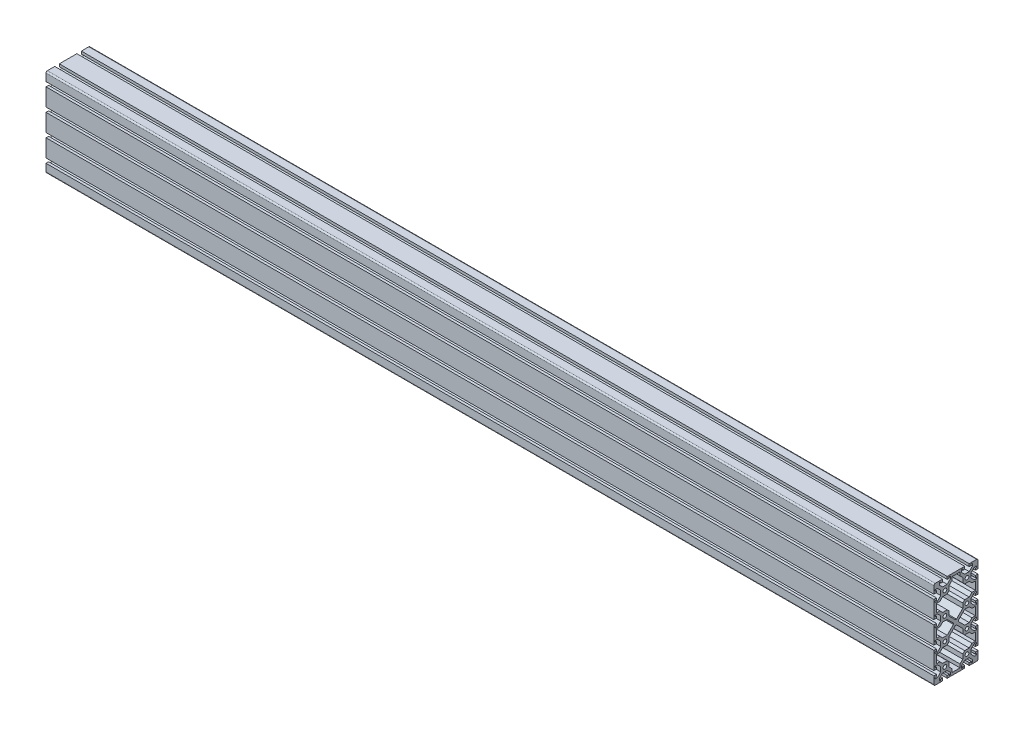
from build123d import *

# Parameters (mm, degrees)
SKETCH22_R                    = 3.35
F_80_SERIES_TS80_160M_1_DEPTH = 1610
M8X1_25_TAPPED_HOLE1_D        = 6.8
M8X1_25_TAPPED_HOLE1_DEPTH    = 30
M8X1_25_TAPPED_HOLE1_TIP      = 2.042926105
M8X1_25_TAPPED_HOLE2_D        = 6.8
M8X1_25_TAPPED_HOLE2_DEPTH    = 30
M8X1_25_TAPPED_HOLE2_TIP      = 2.042926105


with BuildPart() as part:
    # Sketch22 → 80 series TS80-160M(1) (new body)
    with BuildSketch(Plane(origin=(-805, 0, 0), x_dir=(0, 0, -1), z_dir=(1, 0, 0))):
        with BuildLine():
            Line((27.6, -15.9), (27.6, -24.1))
            Line((27.6, -24.1), (33.6, -30.1))
            Line((33.6, -30.1), (37.65, -30.1))
            Line((37.65, -30.1), (37.65, -27.6))
            Line((37.65, -27.6), (35.3, -27.6))
            Line((35.3, -27.6), (35.3, -24.1))
            Line((35.3, -24.1), (40, -24.1))
            Line((40, -24.1), (40, -55.9))
            Line((40, -55.9), (35.3, -55.9))
            Line((35.3, -55.9), (35.3, -52.4))
            Line((35.3, -52.4), (37.65, -52.4))
            Line((37.65, -52.4), (37.65, -49.9))
            Line((37.65, -49.9), (33.6, -49.9))
            Line((33.6, -49.9), (27.6, -55.9))
            Line((27.6, -55.9), (27.6, -64.1))
            Line((27.6, -64.1), (33.6, -70.1))
            Line((33.6, -70.1), (37.65, -70.1))
            Line((37.65, -70.1), (37.65, -67.6))
            Line((37.65, -67.6), (35.3, -67.6))
            Line((35.3, -67.6), (35.3, -64.1))
            Line((35.3, -64.1), (40, -64.1))
            Line((40, -64.1), (40, -77.5))
            ThreePointArc((40, -77.5), (39.267766953, -79.267766953), (37.5, -80))
            Line((37.5, -80), (24.1, -80))
            Line((24.1, -80), (24.1, -75.3))
            Line((24.1, -75.3), (27.6, -75.3))
            Line((27.6, -75.3), (27.6, -77.65))
            Line((27.6, -77.65), (30.1, -77.65))
            Line((30.1, -77.65), (30.1, -73.6))
            Line((30.1, -73.6), (24.1, -67.6))
            Line((24.1, -67.6), (15.9, -67.6))
            Line((15.9, -67.6), (9.9, -73.6))
            Line((9.9, -73.6), (9.9, -77.65))
            Line((9.9, -77.65), (12.4, -77.65))
            Line((12.4, -77.65), (12.4, -75.3))
            Line((12.4, -75.3), (15.9, -75.3))
            Line((15.9, -75.3), (15.9, -80))
            Line((15.9, -80), (-15.9, -80))
            Line((-15.9, -80), (-15.9, -75.3))
            Line((-15.9, -75.3), (-12.4, -75.3))
            Line((-12.4, -75.3), (-12.4, -77.65))
            Line((-12.4, -77.65), (-9.9, -77.65))
            Line((-9.9, -77.65), (-9.9, -73.6))
            Line((-9.9, -73.6), (-15.9, -67.6))
            Line((-15.9, -67.6), (-24.1, -67.6))
            Line((-24.1, -67.6), (-30.1, -73.6))
            Line((-30.1, -73.6), (-30.1, -77.65))
            Line((-30.1, -77.65), (-27.6, -77.65))
            Line((-27.6, -77.65), (-27.6, -75.3))
            Line((-27.6, -75.3), (-24.1, -75.3))
            Line((-24.1, -75.3), (-24.1, -80))
            Line((-24.1, -80), (-37.5, -80))
            ThreePointArc((-37.5, -80), (-39.267766953, -79.267766953), (-40, -77.5))
            Line((-40, -77.5), (-40, -64.1))
            Line((-40, -64.1), (-35.3, -64.1))
            Line((-35.3, -64.1), (-35.3, -67.6))
            Line((-35.3, -67.6), (-37.65, -67.6))
            Line((-37.65, -67.6), (-37.65, -70.1))
            Line((-37.65, -70.1), (-33.6, -70.1))
            Line((-33.6, -70.1), (-27.6, -64.1))
            Line((-27.6, -64.1), (-27.6, -55.9))
            Line((-27.6, -55.9), (-33.6, -49.9))
            Line((-33.6, -49.9), (-37.65, -49.9))
            Line((-37.65, -49.9), (-37.65, -52.4))
            Line((-37.65, -52.4), (-35.3, -52.4))
            Line((-35.3, -52.4), (-35.3, -55.9))
            Line((-35.3, -55.9), (-40, -55.9))
            Line((-40, -55.9), (-40, -24.1))
            Line((-40, -24.1), (-35.3, -24.1))
            Line((-35.3, -24.1), (-35.3, -27.6))
            Line((-35.3, -27.6), (-37.65, -27.6))
            Line((-37.65, -27.6), (-37.65, -30.1))
            Line((-37.65, -30.1), (-33.6, -30.1))
            Line((-33.6, -30.1), (-27.6, -24.1))
            Line((-27.6, -24.1), (-27.6, -15.9))
            Line((-27.6, -15.9), (-33.6, -9.9))
            Line((-33.6, -9.9), (-37.65, -9.9))
            Line((-37.65, -9.9), (-37.65, -12.4))
            Line((-37.65, -12.4), (-35.3, -12.4))
            Line((-35.3, -12.4), (-35.3, -15.9))
            Line((-35.3, -15.9), (-40, -15.9))
            Line((-40, -15.9), (-40, 15.9))
            Line((-40, 15.9), (-35.3, 15.9))
            Line((-35.3, 15.9), (-35.3, 12.4))
            Line((-35.3, 12.4), (-37.65, 12.4))
            Line((-37.65, 12.4), (-37.65, 9.9))
            Line((-37.65, 9.9), (-33.6, 9.9))
            Line((-33.6, 9.9), (-27.6, 15.9))
            Line((-27.6, 15.9), (-27.6, 24.1))
            Line((-27.6, 24.1), (-33.6, 30.1))
            Line((-33.6, 30.1), (-37.65, 30.1))
            Line((-37.65, 30.1), (-37.65, 27.6))
            Line((-37.65, 27.6), (-35.3, 27.6))
            Line((-35.3, 27.6), (-35.3, 24.1))
            Line((-35.3, 24.1), (-40, 24.1))
            Line((-40, 24.1), (-40, 55.9))
            Line((-40, 55.9), (-35.3, 55.9))
            Line((-35.3, 55.9), (-35.3, 52.4))
            Line((-35.3, 52.4), (-37.65, 52.4))
            Line((-37.65, 52.4), (-37.65, 49.9))
            Line((-37.65, 49.9), (-33.6, 49.9))
            Line((-33.6, 49.9), (-27.6, 55.9))
            Line((-27.6, 55.9), (-27.6, 64.1))
            Line((-27.6, 64.1), (-33.6, 70.1))
            Line((-33.6, 70.1), (-37.65, 70.1))
            Line((-37.65, 70.1), (-37.65, 67.6))
            Line((-37.65, 67.6), (-35.3, 67.6))
            Line((-35.3, 67.6), (-35.3, 64.1))
            Line((-35.3, 64.1), (-40, 64.1))
            Line((-40, 64.1), (-40, 77.5))
            ThreePointArc((-40, 77.5), (-39.267766953, 79.267766953), (-37.5, 80))
            Line((-37.5, 80), (-24.1, 80))
            Line((-24.1, 80), (-24.1, 75.3))
            Line((-24.1, 75.3), (-27.6, 75.3))
            Line((-27.6, 75.3), (-27.6, 77.65))
            Line((-27.6, 77.65), (-30.1, 77.65))
            Line((-30.1, 77.65), (-30.1, 73.6))
            Line((-30.1, 73.6), (-24.1, 67.6))
            Line((-24.1, 67.6), (-15.9, 67.6))
            Line((-15.9, 67.6), (-9.9, 73.6))
            Line((-9.9, 73.6), (-9.9, 77.65))
            Line((-9.9, 77.65), (-12.4, 77.65))
            Line((-12.4, 77.65), (-12.4, 75.3))
            Line((-12.4, 75.3), (-15.9, 75.3))
            Line((-15.9, 75.3), (-15.9, 80))
            Line((-15.9, 80), (15.9, 80))
            Line((15.9, 80), (15.9, 75.3))
            Line((15.9, 75.3), (12.4, 75.3))
            Line((12.4, 75.3), (12.4, 77.65))
            Line((12.4, 77.65), (9.9, 77.65))
            Line((9.9, 77.65), (9.9, 73.6))
            Line((9.9, 73.6), (15.9, 67.6))
            Line((15.9, 67.6), (24.1, 67.6))
            Line((24.1, 67.6), (30.1, 73.6))
            Line((30.1, 73.6), (30.1, 77.65))
            Line((30.1, 77.65), (27.6, 77.65))
            Line((27.6, 77.65), (27.6, 75.3))
            Line((27.6, 75.3), (24.1, 75.3))
            Line((24.1, 75.3), (24.1, 80))
            Line((24.1, 80), (37.5, 80))
            ThreePointArc((37.5, 80), (39.267766953, 79.267766953), (40, 77.5))
            Line((40, 77.5), (40, 64.1))
            Line((40, 64.1), (35.3, 64.1))
            Line((35.3, 64.1), (35.3, 67.6))
            Line((35.3, 67.6), (37.65, 67.6))
            Line((37.65, 67.6), (37.65, 70.1))
            Line((37.65, 70.1), (33.6, 70.1))
            Line((33.6, 70.1), (27.6, 64.1))
            Line((27.6, 64.1), (27.6, 55.9))
            Line((27.6, 55.9), (33.6, 49.9))
            Line((33.6, 49.9), (37.65, 49.9))
            Line((37.65, 49.9), (37.65, 52.4))
            Line((37.65, 52.4), (35.3, 52.4))
            Line((35.3, 52.4), (35.3, 55.9))
            Line((35.3, 55.9), (40, 55.9))
            Line((40, 55.9), (40, 24.1))
            Line((40, 24.1), (35.3, 24.1))
            Line((35.3, 24.1), (35.3, 27.6))
            Line((35.3, 27.6), (37.65, 27.6))
            Line((37.65, 27.6), (37.65, 30.1))
            Line((37.65, 30.1), (33.6, 30.1))
            Line((33.6, 30.1), (27.6, 24.1))
            Line((27.6, 24.1), (27.6, 15.9))
            Line((27.6, 15.9), (33.6, 9.9))
            Line((33.6, 9.9), (37.65, 9.9))
            Line((37.65, 9.9), (37.65, 12.4))
            Line((37.65, 12.4), (35.3, 12.4))
            Line((35.3, 12.4), (35.3, 15.9))
            Line((35.3, 15.9), (40, 15.9))
            Line((40, 15.9), (40, -15.9))
            Line((40, -15.9), (35.3, -15.9))
            Line((35.3, -15.9), (35.3, -12.4))
            Line((35.3, -12.4), (37.65, -12.4))
            Line((37.65, -12.4), (37.65, -9.9))
            Line((37.65, -9.9), (33.6, -9.9))
            Line((33.6, -9.9), (27.6, -15.9))
        make_face()
        with Locations((20, -60)):
            Circle(SKETCH22_R, mode=Mode.SUBTRACT)
        with Locations((20, -20)):
            Circle(SKETCH22_R, mode=Mode.SUBTRACT)
        with Locations((20, 20)):
            Circle(SKETCH22_R, mode=Mode.SUBTRACT)
        with Locations((20, 60)):
            Circle(SKETCH22_R, mode=Mode.SUBTRACT)
        with Locations((-20, 60)):
            Circle(SKETCH22_R, mode=Mode.SUBTRACT)
        with Locations((-20, 20)):
            Circle(SKETCH22_R, mode=Mode.SUBTRACT)
        with Locations((-20, -20)):
            Circle(SKETCH22_R, mode=Mode.SUBTRACT)
        with Locations((-20, -60)):
            Circle(SKETCH22_R, mode=Mode.SUBTRACT)
        Polygon((20, -27.6), (24.1, -27.6), (29.1, -32.6), (35.3, -32.6), (35.3, -47.4), (29.1, -47.4), (24.1, -52.4), (20, -52.4), (15.9, -52.4), (12.4, -55.9), (12.4, -60), (12.4, -64.1), (7.4, -69.1), (7.4, -75.3), (-7.4, -75.3), (-7.4, -69.1), (-12.4, -64.1), (-12.4, -60), (-12.4, -55.9), (-15.9, -52.4), (-20, -52.4), (-24.1, -52.4), (-29.1, -47.4), (-35.3, -47.4), (-35.3, -32.6), (-29.1, -32.6), (-24.1, -27.6), (-20, -27.6), (-15.9, -27.6), (-12.4, -24.1), (-12.4, -15.9), (-1, -4.5), (1, -4.5), (12.4, -15.9), (12.4, -24.1), (15.9, -27.6), align=None, mode=Mode.SUBTRACT)
        Polygon((20, -12.4), (24.1, -12.4), (29.1, -7.4), (35.3, -7.4), (35.3, 7.4), (29.1, 7.4), (24.1, 12.4), (20, 12.4), (15.9, 12.4), (4.5, 1), (4.5, -1), (15.9, -12.4), align=None, mode=Mode.SUBTRACT)
        Polygon((12.4, 55.9), (12.4, 60), (12.4, 64.1), (7.4, 69.1), (7.4, 75.3), (-7.4, 75.3), (-7.4, 69.1), (-12.4, 64.1), (-12.4, 60), (-12.4, 55.9), (-15.9, 52.4), (-20, 52.4), (-24.1, 52.4), (-29.1, 47.4), (-35.3, 47.4), (-35.3, 32.6), (-29.1, 32.6), (-24.1, 27.6), (-20, 27.6), (-15.9, 27.6), (-12.4, 24.1), (-12.4, 15.9), (-1, 4.5), (1, 4.5), (12.4, 15.9), (12.4, 24.1), (15.9, 27.6), (20, 27.6), (24.1, 27.6), (29.1, 32.6), (35.3, 32.6), (35.3, 47.4), (29.1, 47.4), (24.1, 52.4), (20, 52.4), (15.9, 52.4), align=None, mode=Mode.SUBTRACT)
        Polygon((-20, 12.4), (-24.1, 12.4), (-29.1, 7.4), (-35.3, 7.4), (-35.3, -7.4), (-29.1, -7.4), (-24.1, -12.4), (-20, -12.4), (-15.9, -12.4), (-4.5, -1), (-4.5, 1), (-15.9, 12.4), align=None, mode=Mode.SUBTRACT)
    extrude(amount=F_80_SERIES_TS80_160M_1_DEPTH)

    # M8x1.25 Tapped Hole1
    with Locations(Plane.ZY.offset(805)):
        with Locations((-20, 60), (20, 60), (-20, -60), (20, -60)):
            Hole(M8X1_25_TAPPED_HOLE1_D / 2, depth=M8X1_25_TAPPED_HOLE1_DEPTH)
            with Locations((0, 0, -(M8X1_25_TAPPED_HOLE1_DEPTH + M8X1_25_TAPPED_HOLE1_TIP / 2))):  # 118° drill point
                Cone(0, M8X1_25_TAPPED_HOLE1_D / 2, M8X1_25_TAPPED_HOLE1_TIP, mode=Mode.SUBTRACT)

    # M8x1.25 Tapped Hole2
    with Locations(Plane(origin=(805, 0, 0), x_dir=(0, 0, -1), z_dir=(1, 0, 0))):
        with Locations((-20, 60), (20, 60), (20, -60), (-20, -60)):
            Hole(M8X1_25_TAPPED_HOLE2_D / 2, depth=M8X1_25_TAPPED_HOLE2_DEPTH)
            with Locations((0, 0, -(M8X1_25_TAPPED_HOLE2_DEPTH + M8X1_25_TAPPED_HOLE2_TIP / 2))):  # 118° drill point
                Cone(0, M8X1_25_TAPPED_HOLE2_D / 2, M8X1_25_TAPPED_HOLE2_TIP, mode=Mode.SUBTRACT)


solid = part.part
